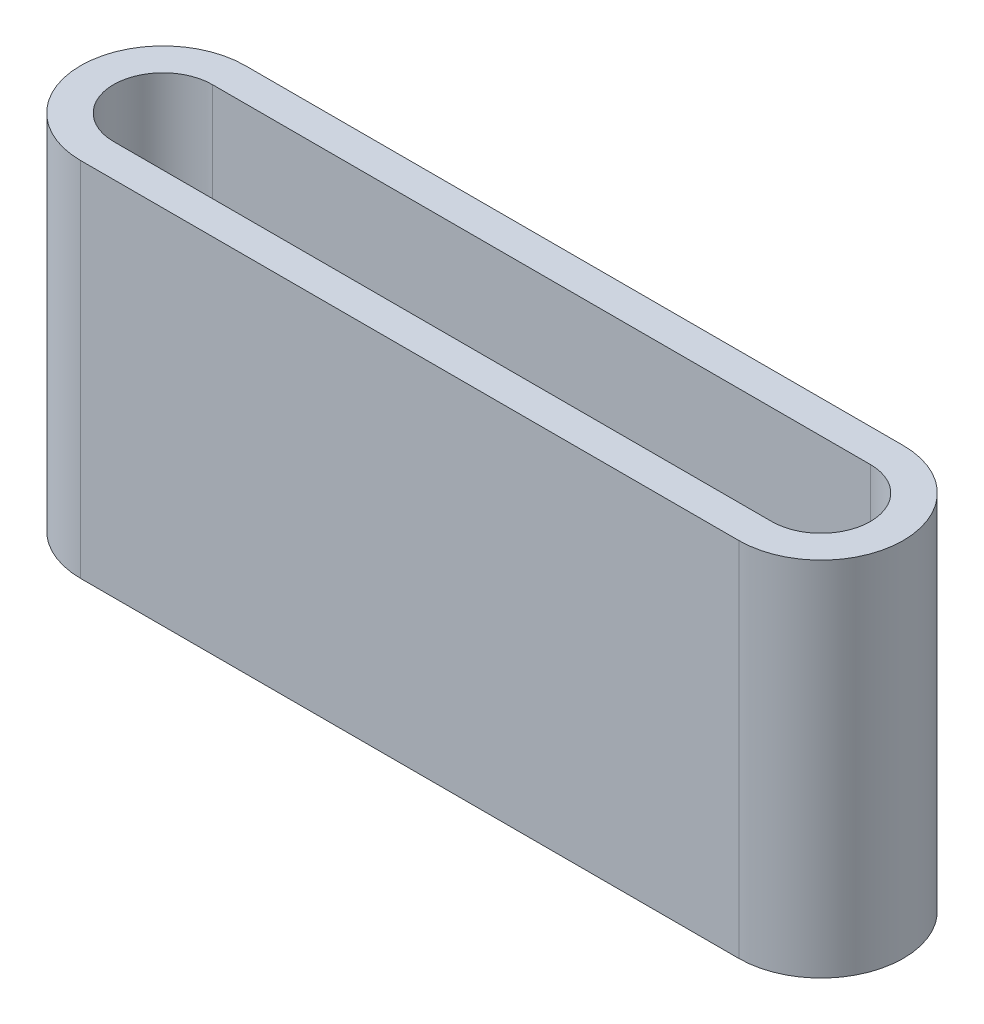
from build123d import *

# Parameters (mm, degrees)
EXTRUDE_1_DEPTH   = 20
EXTRUDE_1_2_DEPTH = 55


with BuildPart() as part:
    # 草图1 → Extrude 1 (new body)
    with BuildSketch(Plane(origin=(0, 0, 0), x_dir=(1, 0, 0), z_dir=(0, 1, 0))):
        with BuildLine():
            Line((0, 12.5), (100, 12.5))
            ThreePointArc((100, 12.5), (112.5, 0), (100, -12.5))
            Line((100, -12.5), (0, -12.5))
            ThreePointArc((0, -12.5), (-12.5, 0), (0, 12.5))
        make_face()
    extrude(amount=EXTRUDE_1_DEPTH)

    # 草图2 → Extrude 1 2 (add)
    with BuildSketch(Plane.XZ):
        with BuildLine():
            Line((100, 12.5), (0, 12.5))
            ThreePointArc((0, 12.5), (-12.5, 0), (0, -12.5))
            Line((0, -12.5), (100, -12.5))
            ThreePointArc((100, -12.5), (112.5, 0), (100, 12.5))
        make_face()
        with BuildLine():
            Line((100, 7.5), (0, 7.5))
            ThreePointArc((0, 7.5), (-7.5, 0), (0, -7.5))
            Line((0, -7.5), (100, -7.5))
            ThreePointArc((100, -7.5), (107.5, 0), (100, 7.5))
        make_face(mode=Mode.SUBTRACT)
    extrude(amount=-EXTRUDE_1_2_DEPTH)


solid = part.part
